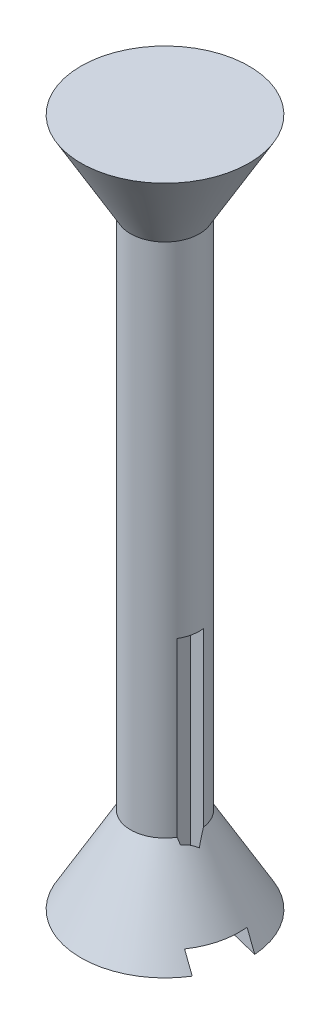
from build123d import *

# Parameters (mm, degrees)
CUT_EXTRUDE_START    = -195
CUT_EXTRUDE_3_DEPTH  = 5
SKETCH_33_R          = 1.6
CUT_EXTRUDE_6_DEPTH  = 10
CUT_EXTRUDE_START_2  = -10
CUT_EXTRUDE_21_DEPTH = 60


with BuildPart() as part:
    # 草图24 → 旋转4 (revolve)
    with BuildSketch(Plane.XY):
        Polygon((-45.743520691, 338.209134615), (-21.309763961, 338.209134615), (-21.309763961, 138.209134615), (-45.743520691, 138.209134615), (-31.309763961, 163.209134615), (-31.309763961, 313.209134615), align=None)
    revolve(axis=Axis((-21.309763961, 338.209134615, 0), (0, -1, 0)))

    # 草图29 → 切除-拉伸3 (cut)
    with BuildSketch(Plane(origin=(0, 338.209134615, 0), x_dir=(1, 0, 0), z_dir=(0, 1, 0)).offset(CUT_EXTRUDE_START)):
        Polygon((-21.309763961, 0), (-19.510610987, 7.281006014), (-42.085820567, 12.859391114), align=None)
        with BuildLine():
            ThreePointArc((3.123992769, 0), (3.109139711, 0.851828276), (3.064598594, 1.702620914))
            Line((3.064598594, 1.702620914), (-21.309763961, 0))
            Line((-21.309763961, 0), (-0.533707355, -12.859391114))
            ThreePointArc((-0.533707355, -12.859391114), (2.191784721, -6.684734662), (3.123992769, 0))
        make_face()
        with BuildLine():
            Line((-45.684126516, -1.702620914), (-21.309763961, 0))
            Line((-21.309763961, 0), (-42.085820567, 12.859391114))
            ThreePointArc((-42.085820567, 12.859391114), (-45.030074587, 5.861342146), (-45.684126516, -1.702620914))
        make_face()
        Polygon((-23.108916935, -7.281006014), (-21.309763961, 0), (-45.684126516, -1.702620914), align=None)
        Polygon((-21.309763961, 0), (3.064598594, 1.702620914), (-19.510610987, 7.281006014), align=None)
        Polygon((-0.533707355, -12.859391114), (-21.309763961, 0), (-23.108916935, -7.281006014), align=None)
    extrude(amount=-CUT_EXTRUDE_3_DEPTH, mode=Mode.SUBTRACT)

    # 草图33 → 切除-拉伸6 (cut)
    with BuildSketch(Plane.XZ.offset(-143.209134615)):
        with Locations(Location((-28.909264197, -1.519900047, 0), (0, 0, 270))):
            Circle(SKETCH_33_R)
        with Locations(Location((-13.730491725, 1.619346078, 0), (0, 0, 270))):
            Circle(SKETCH_33_R)
    extrude(amount=-CUT_EXTRUDE_6_DEPTH, mode=Mode.SUBTRACT)

    # 草图35 → 切除-拉伸21 (cut)
    with BuildSketch(Plane.XZ.offset(-143.209134615).offset(CUT_EXTRUDE_START_2)):
        Polygon((-24.909264197, -1.519900047), (-26.909264197, 1.944201568), (-30.909264197, 1.944201568), (-32.909264197, -1.519900047), (-30.909264197, -4.984001662), (-26.909264197, -4.984001662), align=None)
        Polygon((-9.730491725, 1.619346078), (-11.730491725, 5.083447693), (-15.730491725, 5.083447693), (-17.730491725, 1.619346078), (-15.730491725, -1.844755537), (-11.730491725, -1.844755537), align=None)
    extrude(amount=-CUT_EXTRUDE_21_DEPTH, mode=Mode.SUBTRACT)


solid = part.part
